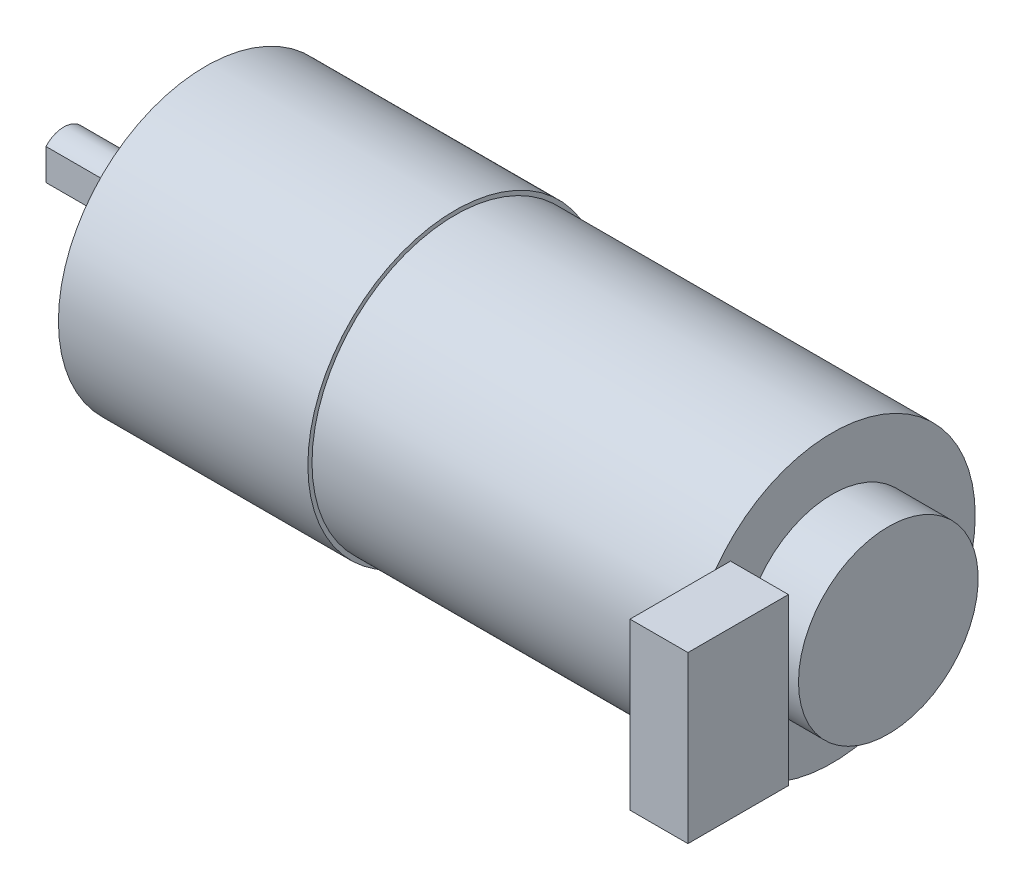
from build123d import *

# Parameters (mm, degrees)
CUT_EXTRUDE1_START  = -8
CUT_EXTRUDE1_DEPTH  = 8
SKETCH4_W           = 8.5
SKETCH4_H           = 14
BOSS_EXTRUDE1_DEPTH = 4.9


with BuildPart() as part:
    # Sketch1 → Revolve5 (revolve)
    with BuildSketch(Plane(origin=(0, 0, 0), x_dir=(1, 0, 0), z_dir=(0, 1, 0))):
        Polygon((4.75, 4.5), (4.75, 12.1), (-65, 12.1), (-65, 10.1), (-55.5, 10.1), (-55.5, 8.6), (-53, 8.6), (-53, -0.35), (-31.9, -0.35), (-31.9, 0), (0, 0), (0, 4.5), align=None)
    revolve(axis=Axis((-65, 0, -12.1), (1, 0, 0)))

    # Sketch2 → Cut-Extrude1 (cut)
    with BuildSketch(Plane.ZY.offset(65).offset(CUT_EXTRUDE1_START)):
        with BuildLine():
            ThreePointArc((-10.6, -1.322875656), (-10.1, 0), (-10.6, 1.322875656))
            Line((-10.6, 1.322875656), (-10.6, -1.322875656))
        make_face()
    extrude(amount=CUT_EXTRUDE1_DEPTH, mode=Mode.SUBTRACT)

    # Sketch4 → Boss-Extrude1 (add)
    with BuildSketch(Plane(origin=(0, 0, 0), x_dir=(0, 0, -1), z_dir=(1, 0, 0))):
        with Locations((-0.75, 0)):
            Rectangle(SKETCH4_W, SKETCH4_H)
    extrude(amount=BOSS_EXTRUDE1_DEPTH)


solid = part.part
